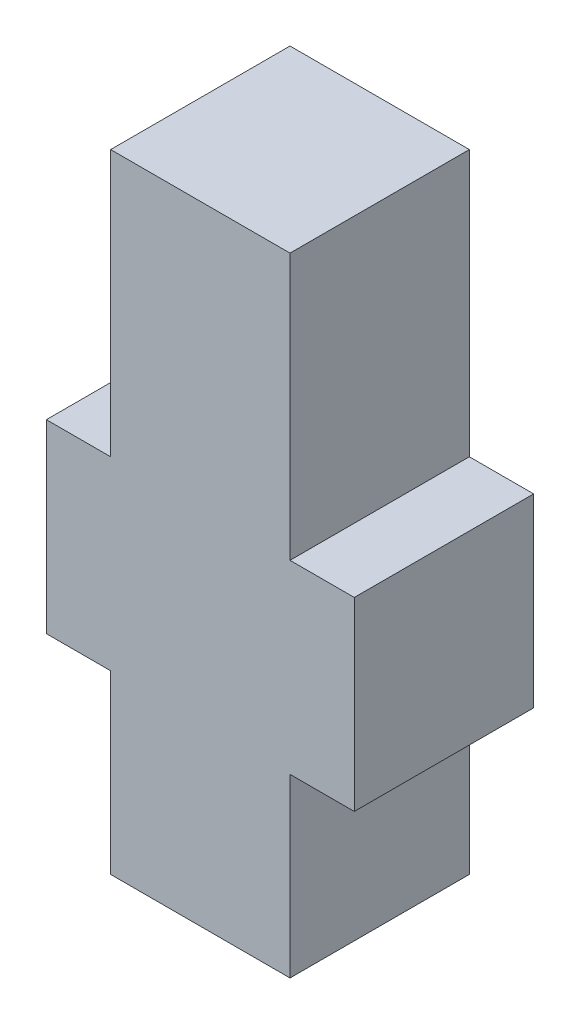
from build123d import *

# Parameters (mm, degrees)
SKETCH_6_W             = 6
SKETCH_6_H             = 21
EXTRUDE_1425_DEPTH     = 6
SKETCH_1474_W          = 10.3
SKETCH_1474_H          = 6.2
EXTRUDE_10_3_6_2_DEPTH = 6


with BuildPart() as part:
    # Канал_6 → Extrude 1425 (new body)
    with BuildSketch(Plane.XY):
        with Locations((0, -10.5)):
            Rectangle(SKETCH_6_W, SKETCH_6_H)
    extrude(amount=EXTRUDE_1425_DEPTH)

    # Sketch 1474 → Гайка_10_3х6_2 (add)
    with BuildSketch(Plane.XY):
        with Locations((0, -12)):
            Rectangle(SKETCH_1474_W, SKETCH_1474_H)
    extrude(amount=EXTRUDE_10_3_6_2_DEPTH)


solid = part.part
